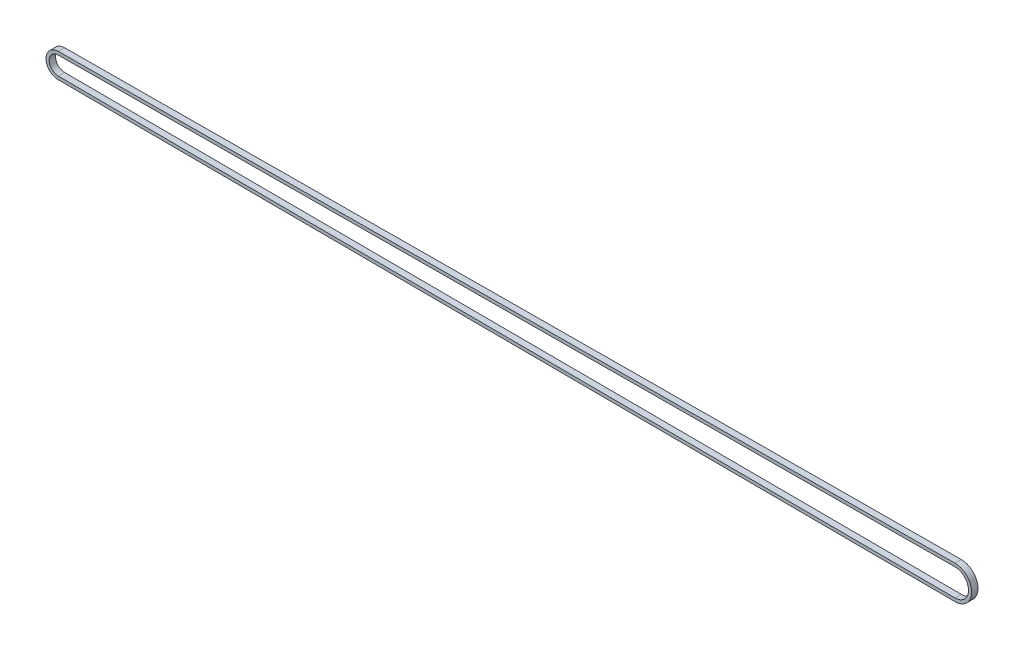
from build123d import *

# Parameters (mm, degrees)
EXTRUDE_THIN1_DEPTH = 4


with BuildPart() as part:
    # Sketch2 → Extrude-Thin1 (new body)
    with BuildSketch(Plane.XY):
        with BuildLine():
            Line((-550.826210376, -54.899506236), (15.053094671, -51.667500281))
            ThreePointArc((15.053094671, -51.667500281), (25.613060379, -62.158384731), (15.070983049, -72.6672447))
            Line((15.070983049, -72.6672447), (-550.81300705, -70.399317593))
            ThreePointArc((-550.81300705, -70.399317593), (-558.531944349, -62.655981574), (-550.826210376, -54.899506236))
        make_face()
        with BuildLine():
            Line((-550.814787611, -56.899473616), (15.064517436, -53.667467661))
            ThreePointArc((15.064517436, -53.667467661), (23.613061105, -62.160088406), (15.078998504, -70.667260762))
            Line((15.078998504, -70.667260762), (-550.804991594, -68.399333655))
            ThreePointArc((-550.804991594, -68.399333655), (-556.531945074, -62.654277899), (-550.814787611, -56.899473616))
        make_face(mode=Mode.SUBTRACT)
    extrude(amount=EXTRUDE_THIN1_DEPTH)


solid = part.part
